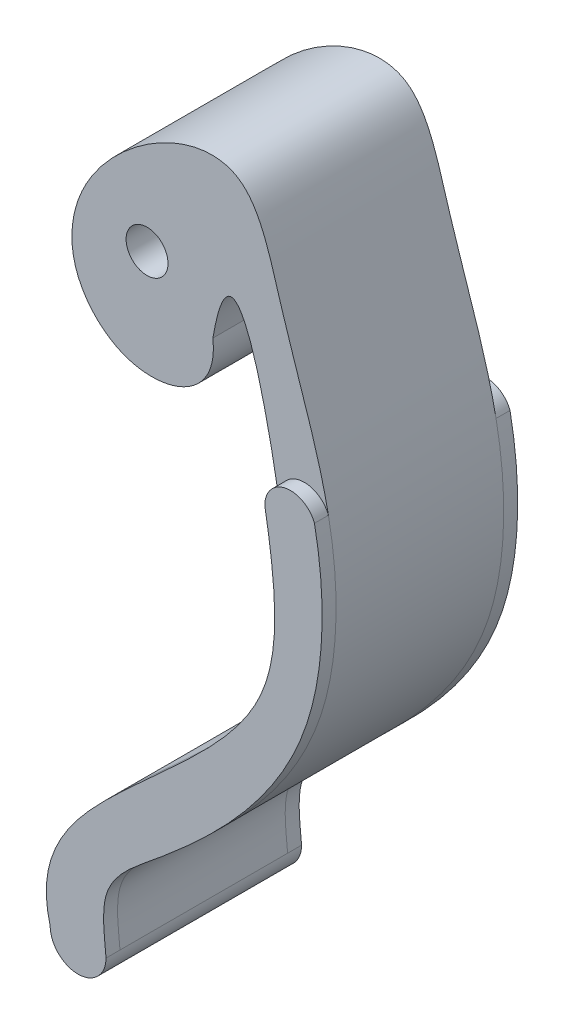
from build123d import *

# Parameters (mm, degrees)
BOSS_EXTRUDE1_DEPTH     = 12
BOSS_EXTRUDE2_START     = -1
BOSS_EXTRUDE2_DEPTH     = 1
CUT_EXTRUDE1_DEPTH      = 1
CUT_EXTRUDE1_DEPTH_BACK = 15
SKETCH3_R               = 1.5


with BuildPart() as part:
    # Sketch1 → Boss-Extrude1 (new body)
    with BuildSketch(Plane.XY):
        with BuildLine():
            add(Edge.make_bspline(
                [(-2, 0), (-3.140940194, 4.215999285), (2.897299367, 11.458866274), (14.645369919, 20.235192236), (14.131917674, 32.495300457), (10.01815782, 49.403975694), (8.652561543, 41.266287277)],
                knots=[0, 0, 0, 0, 0.216144603, 0.503172391, 0.730636784, 1, 1, 1, 1], degree=3))
            ThreePointArc((-2, 0), (0, -2), (2, 0))
            add(Edge.make_bspline(
                [(1.969038925, 0.350550582), (1.980264052, 0.231412105), (1.990797415, 0.114401394), (2, 0)],
                knots=[0.995861696, 0.995861696, 0.995861696, 0.995861696, 1, 1, 1, 1], degree=3))
            add(Edge.make_bspline(
                [(8.652561543, 41.266287277), (9.101182096, 37.424739651), (3.285287451, 35.236450883), (-2.164103969, 40.539750006), (-0.766840169, 48.981252926), (10.823079093, 55.595684681), (13.255293102, 46.387094965), (15.239986162, 40.553791831), (17.860452771, 32.421452727), (17.386774861, 19.055224431), (8.968579627, 10.47097403), (1.452015647, 4.690133461), (1.860968545, 1.497561301), (1.969038925, 0.350550582)],
                knots=[0, 0, 0, 0, 0.096763848, 0.147229164, 0.224573312, 0.354095969, 0.424863733, 0.483157365, 0.569429769, 0.705070573, 0.901237067, 0.956019997, 0.995861696, 0.995861696, 0.995861696, 0.995861696], degree=3))
        make_face()
    extrude(amount=BOSS_EXTRUDE1_DEPTH)

    # Sketch2 → Boss-Extrude2 (add)
    with BuildSketch(Plane.XY.offset(BOSS_EXTRUDE2_START)):
        with BuildLine():
            add(Edge.make_bspline(
                [(-2, 0), (-3.140940194, 4.215999285), (2.897299367, 11.458866274), (14.508847904, 20.133204279), (14.317138312, 28.017159927), (13.467527866, 33.150418812)],
                knots=[0, 0, 0, 0, 0.216144603, 0.503172391, 0.722146197, 0.722146197, 0.722146197, 0.722146197], degree=3))
            ThreePointArc((-2, 0), (0, -2), (2, 0))
            add(Edge.make_bspline(
                [(1.969038925, 0.350550582), (1.980264052, 0.231412105), (1.990797415, 0.114401394), (2, 0)],
                knots=[0.995861696, 0.995861696, 0.995861696, 0.995861696, 1, 1, 1, 1], degree=3))
            add(Edge.make_bspline(
                [(17.047103274, 33.755381517), (17.762707456, 29.663278524), (17.386774861, 19.055224431), (8.968579627, 10.47097403), (1.452015647, 4.690133461), (1.860968545, 1.497561301), (1.969038925, 0.350550582)],
                knots=[0.569429769, 0.569429769, 0.569429769, 0.569429769, 0.705070573, 0.901237067, 0.956019997, 0.995861696, 0.995861696, 0.995861696, 0.995861696], degree=3))
            add(Edge.make_bspline(
                [(16.923121113, 34.419541133), (16.96686082, 34.198874876), (17.008262493, 33.977488203), (17.047103274, 33.755381517)],
                knots=[0.562067606, 0.562067606, 0.562067606, 0.562067606, 0.569429769, 0.569429769, 0.569429769, 0.569429769], degree=3))
            ThreePointArc((16.923121113, 34.419541133), (14.86837864, 35.565028826), (13.365286725, 33.755381517))
            add(Edge.make_bspline(
                [(13.467527866, 33.150418812), (13.434584699, 33.349458039), (13.40048891, 33.551085395), (13.365286725, 33.755381517)],
                knots=[0.722146197, 0.722146197, 0.722146197, 0.722146197, 0.730636784, 0.730636784, 0.730636784, 0.730636784], degree=3))
        make_face()
    boss_extrude2 = extrude(amount=BOSS_EXTRUDE2_DEPTH)

    # Mirror1: Boss-Extrude2 across plane
    add(boss_extrude2.mirror(Plane.XY.offset(6)))

    # Sketch3 → Cut-Extrude1 (cut, two sides: drawn at the far end of the back side and taken through both)
    with BuildSketch(Plane.XY.offset(12).offset(-CUT_EXTRUDE1_DEPTH_BACK)):
        with Locations(Location((3.93743852, 44.286800206, 0), (0, 0, 180))):
            Circle(SKETCH3_R)
    extrude(amount=CUT_EXTRUDE1_DEPTH + CUT_EXTRUDE1_DEPTH_BACK, mode=Mode.SUBTRACT)


solid = part.part
